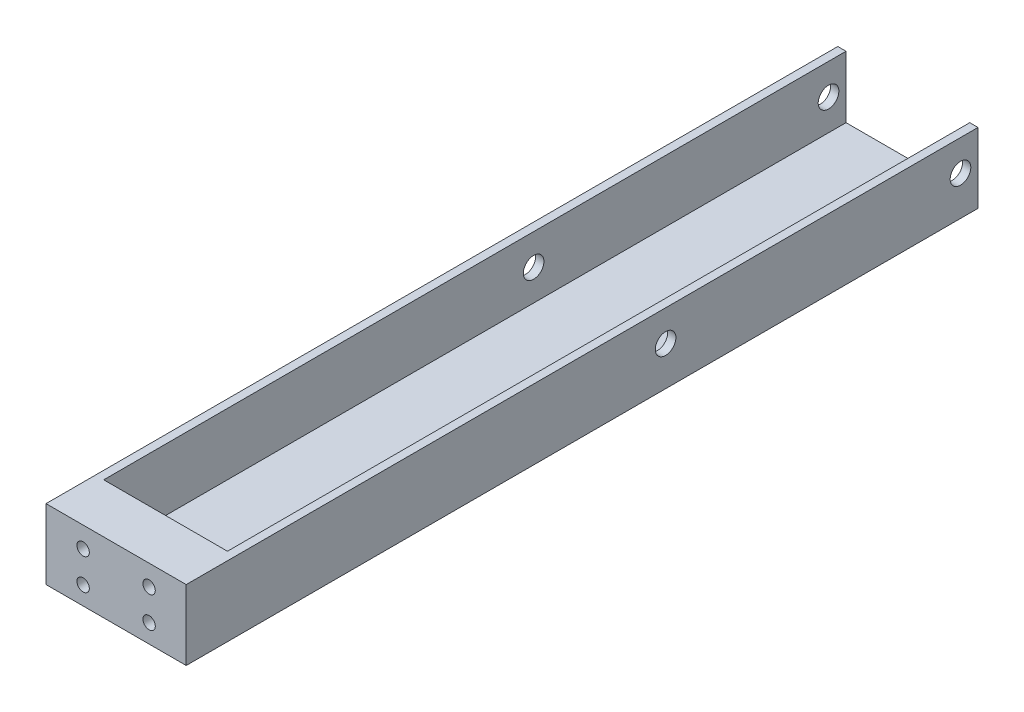
from build123d import *

# Parameters (mm, degrees)
SKETCH1_W               = 30
SKETCH1_H               = 15
BOSS_EXTRUDE1_DEPTH     = 180
SHELL2_T                = 2
SKETCH3_R               = 2.5
CUT_EXTRUDE3_DEPTH      = 50
MIRROR3_COPY_1_SKETCH_R = 2.5
MIRROR3_COPY_1_DEPTH    = 50
SKETCH7_W               = 34
SKETCH7_H               = 17
BOSS_EXTRUDE5_DEPTH     = 10
SKETCH12_R              = 1.5
CUT_EXTRUDE5_DEPTH      = 193.985103052
SKETCH13_R              = 1.5
CUT_EXTRUDE6_DEPTH      = 193.985103052


with BuildPart() as part:
    # Sketch1 → Boss-Extrude1 (new body)
    with BuildSketch(Plane.XY):
        Rectangle(SKETCH1_W, SKETCH1_H)
    extrude(amount=BOSS_EXTRUDE1_DEPTH)

    # Shell2
    shell2_openings = [part.faces().sort_by_distance(p)[0] for p in [
        (0, 7.5, 90),
        (0, 0, 0),
    ]]
    offset(amount=SHELL2_T, openings=shell2_openings, kind=Kind.INTERSECTION)

    # Sketch3 → Cut-Extrude3 (cut)
    with BuildSketch(Plane(origin=(15, 0, 0), x_dir=(0, 0, -1), z_dir=(1, 0, 0))):
        with Locations((-4.245349373, 0)):
            Circle(SKETCH3_R)
    cut_extrude3 = extrude(amount=-CUT_EXTRUDE3_DEPTH, mode=Mode.SUBTRACT)

    # Mirror1: Cut-Extrude3 across plane
    add(cut_extrude3.mirror(Plane.XY.offset(40)), mode=Mode.SUBTRACT)

    # Mirror3: Cut-Extrude3 across plane
    add(cut_extrude3.mirror(Plane(origin=(0, 0, 0), x_dir=(0, 0, 1), z_dir=(1, 0, 0))), mode=Mode.SUBTRACT)

    # Mirror3 copy 1 sketch → Mirror3 copy 1 (cut)
    with BuildSketch(Plane(origin=(-15, 0, 80), x_dir=(0, 0, 1), z_dir=(-1, 0, 0))):
        with Locations((-4.245349373, 0)):
            Circle(MIRROR3_COPY_1_SKETCH_R)
    extrude(amount=-MIRROR3_COPY_1_DEPTH, mode=Mode.SUBTRACT)

    # Sketch7 → Boss-Extrude5 (add)
    with BuildSketch(Plane.XY.offset(182)):
        with Locations((0, -1)):
            Rectangle(SKETCH7_W, SKETCH7_H)
    extrude(amount=BOSS_EXTRUDE5_DEPTH)

    # Sketch12 → Cut-Extrude5 (cut, through all)
    with BuildSketch(Plane.XY.offset(192)):
        with Locations((-8, 2.5)):
            Circle(SKETCH12_R)
        with Locations((-8, -5.054330526)):
            Circle(SKETCH12_R)
        with Locations((8, 2.5)):
            Circle(SKETCH12_R)
    extrude(amount=-CUT_EXTRUDE5_DEPTH, mode=Mode.SUBTRACT)

    # Sketch13 → Cut-Extrude6 (cut, through all)
    with BuildSketch(Plane.XY.offset(192)):
        with Locations((8, -5)):
            Circle(SKETCH13_R)
    extrude(amount=-CUT_EXTRUDE6_DEPTH, mode=Mode.SUBTRACT)


solid = part.part
